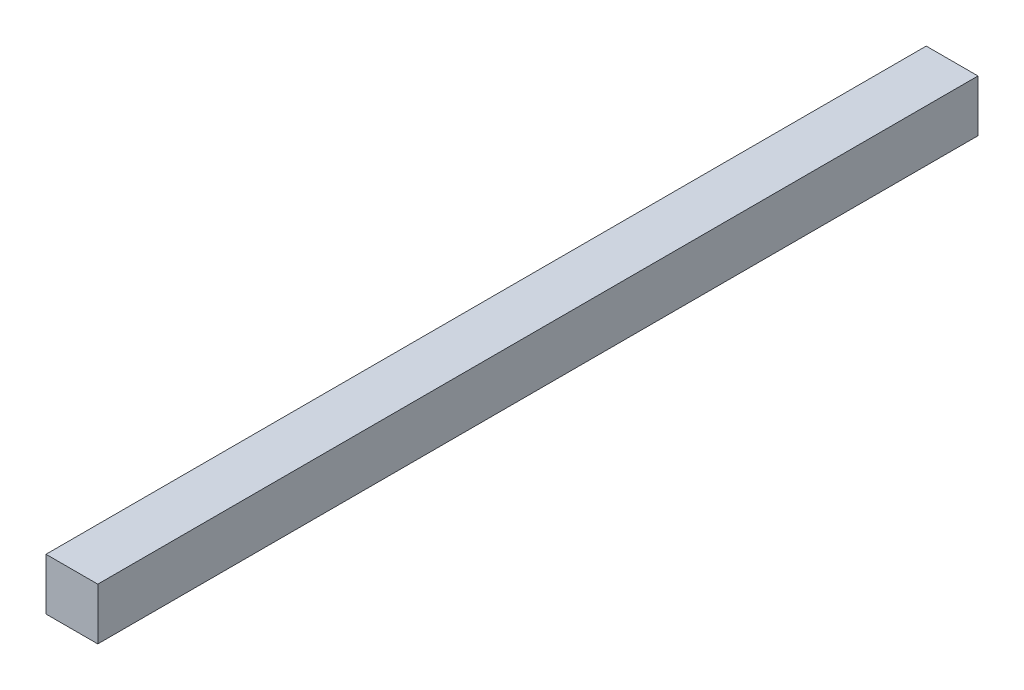
from build123d import *

# Parameters (mm, degrees)
SKETCH_1_W      = 20
SKETCH_1_H      = 20
EXTRUDE_1_DEPTH = 340


with BuildPart() as part:
    # 草圖1 → 填料-伸長1 (new body)
    with BuildSketch(Plane.XY):
        Rectangle(SKETCH_1_W, SKETCH_1_H)
    extrude(amount=EXTRUDE_1_DEPTH)


solid = part.part
